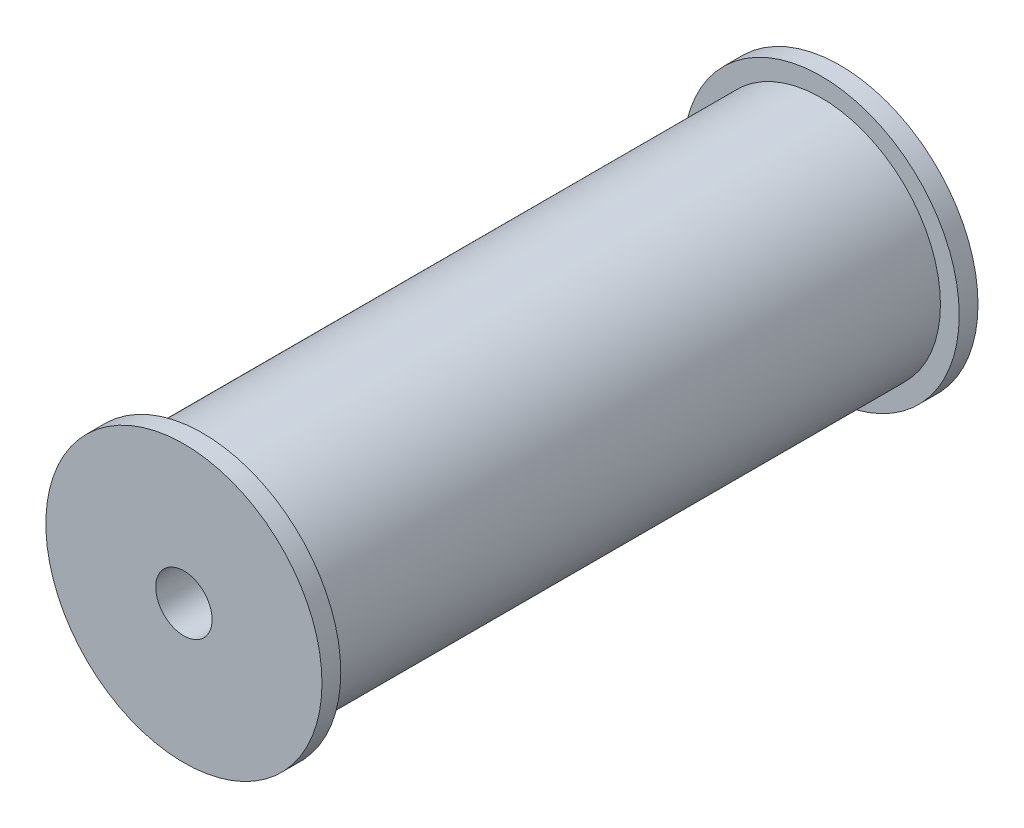
from build123d import *

# Parameters (mm, degrees)
SKETCH1_R           = 12.7
BOSS_EXTRUDE1_DEPTH = 69.85
SKETCH2_R           = 3
CUT_EXTRUDE3_DEPTH  = 69.85
BOSS_EXTRUDE2_START = 2
SKETCH3_R           = 14.7
SKETCH3_R_2         = 3
BOSS_EXTRUDE2_DEPTH = 2
BOSS_EXTRUDE3_START = 69.85
SKETCH3_2_R         = 14.7
SKETCH3_2_R_2       = 3
BOSS_EXTRUDE3_DEPTH = 2


with BuildPart() as part:
    # Sketch1 → Boss-Extrude1 (new body)
    with BuildSketch(Plane.XY):
        Circle(SKETCH1_R)
    extrude(amount=BOSS_EXTRUDE1_DEPTH)

    # Sketch2 → Cut-Extrude3 (cut)
    with BuildSketch(Plane.XY.offset(69.85)):
        Circle(SKETCH2_R)
    extrude(amount=-CUT_EXTRUDE3_DEPTH, mode=Mode.SUBTRACT)

    # Sketch3 → Boss-Extrude2 (add)
    with BuildSketch(Plane.XY.offset(BOSS_EXTRUDE2_START)):
        Circle(SKETCH3_R)
        Circle(SKETCH3_R_2, mode=Mode.SUBTRACT)
    extrude(amount=-BOSS_EXTRUDE2_DEPTH)

    # Sketch3<2> → Boss-Extrude3 (add)
    with BuildSketch(Plane.XY.offset(BOSS_EXTRUDE3_START)):
        Circle(SKETCH3_2_R)
        Circle(SKETCH3_2_R_2, mode=Mode.SUBTRACT)
    extrude(amount=-BOSS_EXTRUDE3_DEPTH)


solid = part.part
